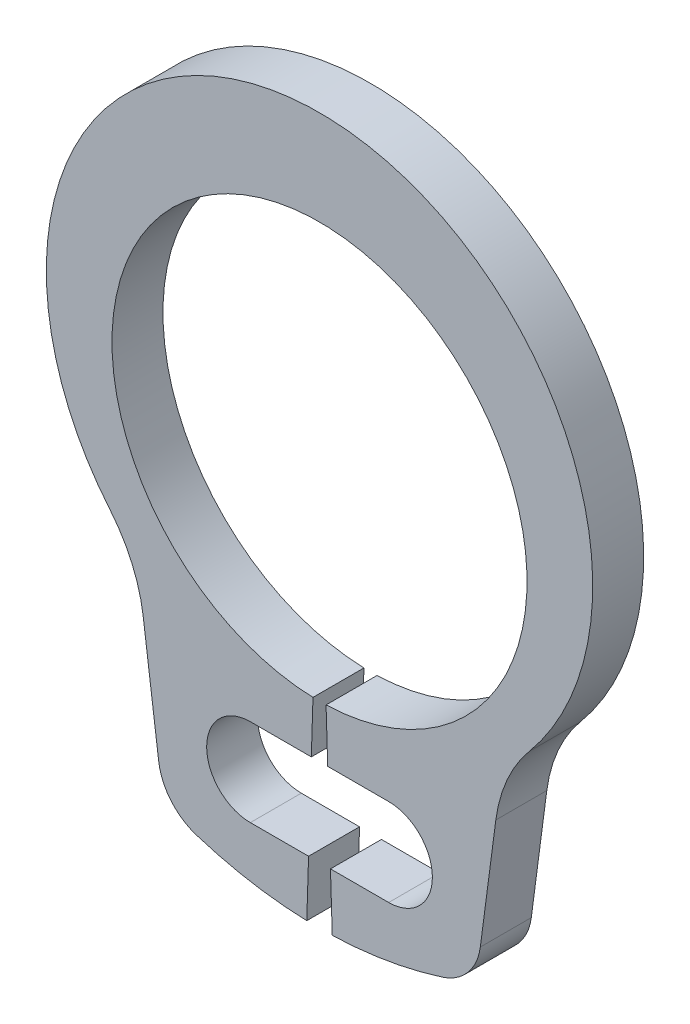
from build123d import *

# Parameters (mm, degrees)
BODYSKE_R   = 0.6
BODY_DEPTH  = 0.7
NOTSKE_W    = 1.9
NOTSKE_H    = 1.2
NOTCH_DEPTH = 7.733295861


with BuildPart() as part:
    # BodySke → Body (new body)
    with BuildSketch(Plane.XY):
        with BuildLine():
            Line((0.089864865, -2.848582859), (0.175, -5.547240305))
            ThreePointArc((0.175, -5.547240305), (0.943397685, -5.469232195), (1.693525559, -5.285307104))
            ThreePointArc((1.693525559, -5.285307104), (2.040324005, -5.051829297), (2.2082544, -4.668971058))
            Line((2.2082544, -4.668971058), (2.421252601, -3.051089095))
            ThreePointArc((2.421252601, -3.051089095), (2.576047275, -2.4964236), (2.879326572, -2.006896409))
            ThreePointArc((2.879326572, -2.006896409), (0, 4.15), (-2.879326572, -2.006896409))
            ThreePointArc((-2.879326572, -2.006896409), (-2.576047275, -2.4964236), (-2.421252601, -3.051089095))
            Line((-2.421252601, -3.051089095), (-2.2082544, -4.668971058))
            ThreePointArc((-2.2082544, -4.668971058), (-2.040324005, -5.051829297), (-1.693525559, -5.285307104))
            ThreePointArc((-1.693525559, -5.285307104), (-0.943397685, -5.469232195), (-0.175, -5.547240305))
            Line((-0.175, -5.547240305), (-0.089864865, -2.848582859))
            ThreePointArc((-0.089864865, -2.848582859), (0, 2.85), (0.089864865, -2.848582859))
        make_face()
        with Locations((0.95, -4.168108084)):
            Circle(BODYSKE_R, mode=Mode.SUBTRACT)
        with Locations((-0.95, -4.168108084)):
            Circle(BODYSKE_R, mode=Mode.SUBTRACT)
    extrude(amount=-BODY_DEPTH)

    # NotSke → Notch (cut, through all)
    with BuildSketch(Plane.XY):
        with Locations((0, -4.168108084)):
            Rectangle(NOTSKE_W, NOTSKE_H)
    extrude(amount=-NOTCH_DEPTH, mode=Mode.SUBTRACT)


solid = part.part
